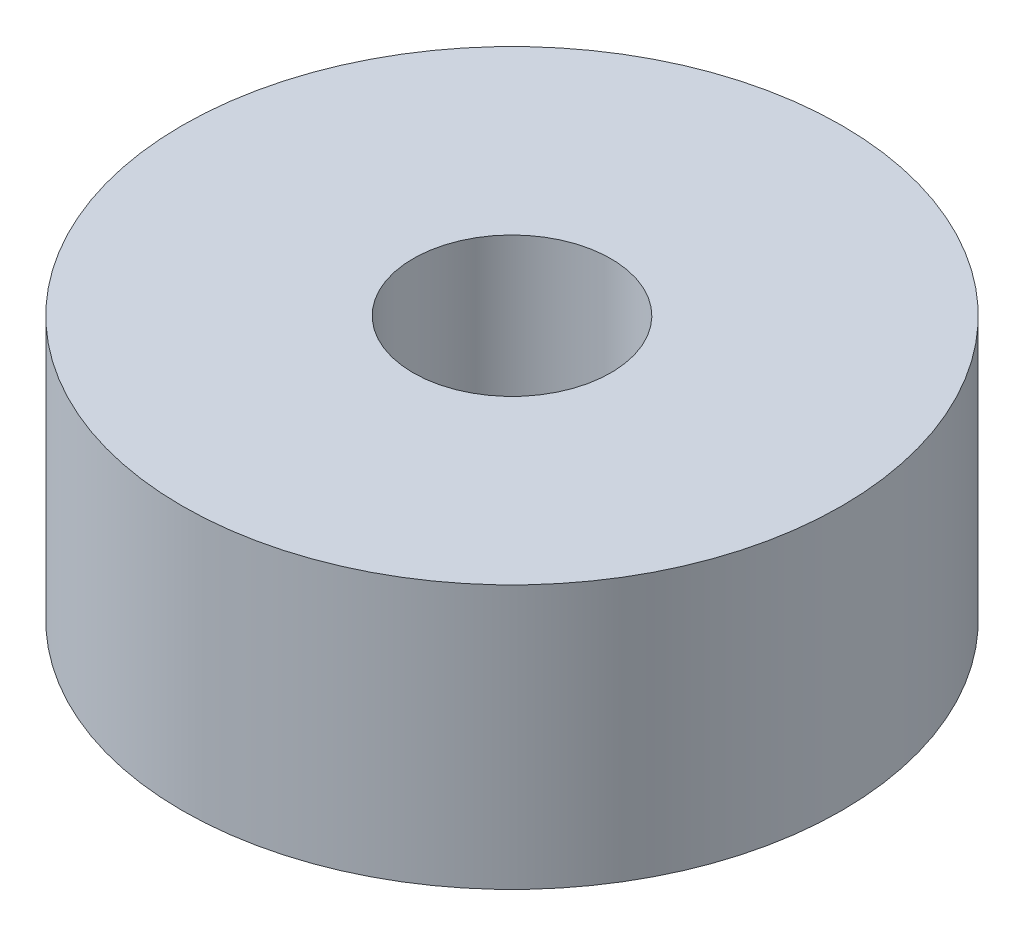
from build123d import *

# Parameters (mm, degrees)
SKETCH1_R           = 5
BOSS_EXTRUDE1_DEPTH = 4
SKETCH2_R           = 1.5
CUT_EXTRUDE1_DEPTH  = 6


with BuildPart() as part:
    # Sketch1 → Boss-Extrude1 (new body)
    with BuildSketch(Plane(origin=(0, 0, 0), x_dir=(1, 0, 0), z_dir=(0, 1, 0))):
        with Locations(Location((0, 0, 0), (0, 0, 270))):
            Circle(SKETCH1_R)
    extrude(amount=BOSS_EXTRUDE1_DEPTH)

    # Sketch2 → Cut-Extrude1 (cut)
    with BuildSketch(Plane(origin=(0, 4, 0), x_dir=(1, 0, 0), z_dir=(0, 1, 0))):
        with Locations(Location((0, 0, 0), (0, 0, 270))):
            Circle(SKETCH2_R)
    extrude(amount=-CUT_EXTRUDE1_DEPTH, mode=Mode.SUBTRACT)


solid = part.part
